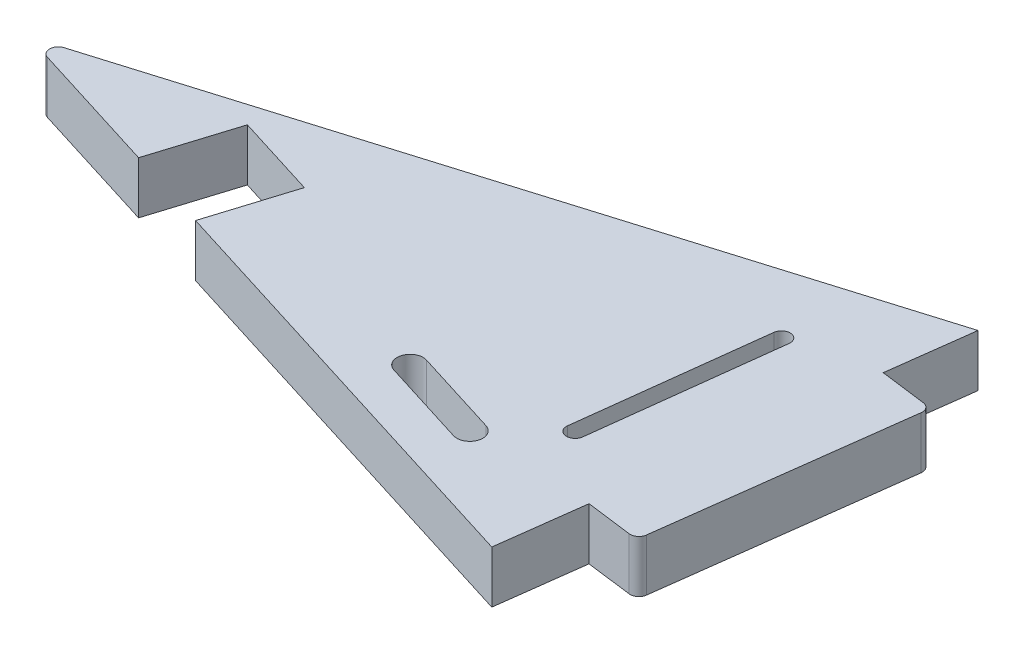
from build123d import *

# Parameters (mm, degrees)
BOSS_EXTRUDE1_DEPTH = 6
FILLET1_R           = 1
CUT_EXTRUDE1_DEPTH  = 93.288252623


with BuildPart() as part:
    # Sketch1 → Boss-Extrude1 (new body)
    with BuildSketch(Plane(origin=(0, 0, 0), x_dir=(1, 0, 0), z_dir=(0, 1, 0))):
        Polygon((-2.58662904, -0.182978259), (-1.306630871, 9.734763655), (4.991135245, 8.921964817), (8.862776708, 38.921964817), (2.565209371, 39.734738), (3.813361808, 49.405731314), (-80.122978657, 24.047130996), (-50.562245366, 14.809401842), (-40.870201664, 11.780638185), align=None)
        with BuildLine():
            Line((-5.765677194, 37.231163577), (-8.327046549, 16.028717249))
            ThreePointArc((-8.327046549, 16.028717249), (-9.439761879, 15.155868697), (-10.312610431, 16.268584027))
            Line((-10.312610431, 16.268584027), (-7.751241076, 37.471030354))
            ThreePointArc((-7.751241076, 37.471030354), (-6.638525747, 38.343878906), (-5.765677194, 37.231163577))
        make_face(mode=Mode.SUBTRACT)
    extrude(amount=BOSS_EXTRUDE1_DEPTH)

    # Fillet1
    fillet1_edges = [part.edges().sort_by_distance(p)[0] for p in [
        (-80.122978657, 3, -24.047130996),
        (8.862776708, 3, -38.921964817),
        (4.991135245, 3, -8.921964817),
    ]]
    fillet(fillet1_edges, radius=FILLET1_R)

    # Sketch2 → Cut-Extrude1 (cut, through all)
    with BuildSketch(Plane(origin=(0, 6, 0), x_dir=(1, 0, 0), z_dir=(0, 1, 0))):
        Polygon((-61.745288627, 18.304102861), (-58.762538695, 27.848902642), (-49.217738915, 24.86615271), (-52.200488846, 15.32135293), align=None)
        with BuildLine():
            Line((-25.001158575, 14.705103686), (-15.001158575, 11.580103686))
            ThreePointArc((-15.001158575, 11.580103686), (-14.016851097, 9.70097123), (-15.895983554, 8.716663752))
            Line((-15.895983554, 8.716663752), (-25.895983554, 11.841663752))
            ThreePointArc((-25.895983554, 11.841663752), (-26.880291031, 13.720796209), (-25.001158575, 14.705103686))
        make_face()
    extrude(amount=-CUT_EXTRUDE1_DEPTH, mode=Mode.SUBTRACT)


solid = part.part
